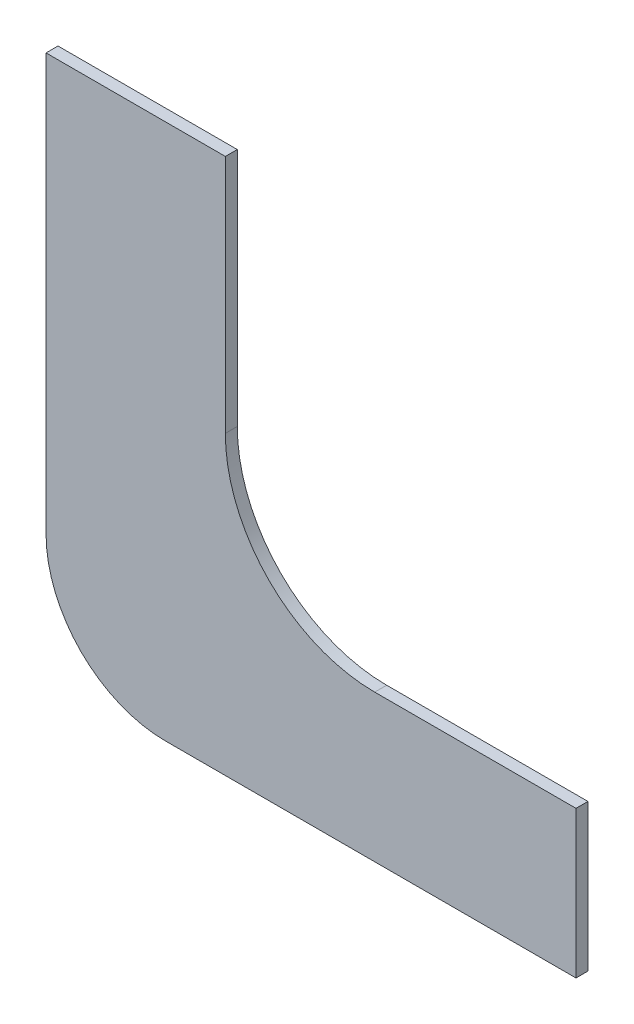
from build123d import *

# Parameters (mm, degrees)
BOSS_EXTRUDE1_DEPTH = 0.01


with BuildPart() as part:
    # Sketch2 → Boss-Extrude1 (new, symmetric)
    with BuildSketch(Plane.XY):
        with BuildLine():
            Line((-0.15, 0.35), (0.15, 0.35))
            Line((0.15, 0.35), (0.15, -0.051374847))
            ThreePointArc((0.15, -0.051374847), (0.223223305, -0.228151543), (0.4, -0.301374847))
            Line((0.4, -0.301374847), (0.736808624, -0.301374847))
            Line((0.736808624, -0.301374847), (0.736808624, -0.547273546))
            Line((0.736808624, -0.547273546), (0.15, -0.547273546))
            Line((0.15, -0.547273546), (0.05, -0.547273546))
            ThreePointArc((0.05, -0.547273546), (-0.091421356, -0.488694902), (-0.15, -0.347273546))
            Line((-0.15, -0.347273546), (-0.15, 0.35))
        make_face()
    extrude(amount=BOSS_EXTRUDE1_DEPTH, both=True)


solid = part.part
